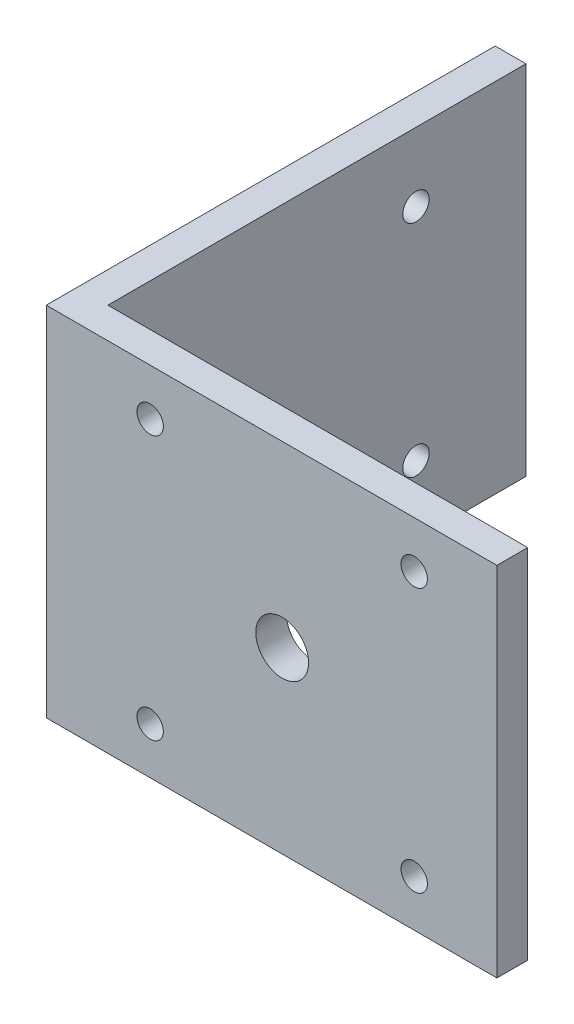
from build123d import *

# Parameters (mm, degrees)
BOSS_EXTRUDE1_DEPTH     = 40.6
CUT_EXTRUDE1_DEPTH      = 81.783971182
CUT_EXTRUDE1_DEPTH_BACK = 81.783971182
SKETCH2_R               = 1.5
CUT_EXTRUDE2_DEPTH      = 81.775305632
CUT_EXTRUDE2_DEPTH_BACK = 81.775305632
SKETCH3_R               = 1.5


with BuildPart() as part:
    # Sketch1 → Boss-Extrude1 (new body)
    with BuildSketch(Plane(origin=(0, 0, 0), x_dir=(1, 0, 0), z_dir=(0, 1, 0))):
        Polygon((0, 0), (0, 51), (3.5, 51), (3.5, 3.5), (51.2, 3.5), (51.2, 0), align=None)
    extrude(amount=BOSS_EXTRUDE1_DEPTH)

    # Sketch2 → Cut-Extrude1 (cut, two sides: drawn at the far end of the back side and taken through both)
    with BuildSketch(Plane(origin=(0, 0, -3.5), x_dir=(-1, 0, 0), z_dir=(0, 0, -1)).offset(-CUT_EXTRUDE1_DEPTH_BACK)):
        with BuildLine():
            ThreePointArc((-10.3, 35.3), (-10.414180701, 35.874025149), (-10.739339828, 36.360660172))
            Line((-10.739339828, 36.360660172), (-12.860660172, 34.239339828))
            ThreePointArc((-12.860660172, 34.239339828), (-11.225974851, 33.914180701), (-10.3, 35.3))
        make_face()
        with BuildLine():
            Line((-12.860660172, 34.239339828), (-10.739339828, 36.360660172))
            ThreePointArc((-10.739339828, 36.360660172), (-12.860660172, 36.360660172), (-12.860660172, 34.239339828))
        make_face()
        with Locations((-41.8, 35.3)):
            Circle(SKETCH2_R)
        with BuildLine():
            ThreePointArc((-23.8, 20.3), (-24.028361402, 21.448050297), (-24.678679656, 22.421320344))
            Line((-24.678679656, 22.421320344), (-28.921320344, 18.178679656))
            ThreePointArc((-28.921320344, 18.178679656), (-25.651949703, 17.528361402), (-23.8, 20.3))
        make_face()
        with BuildLine():
            Line((-28.921320344, 18.178679656), (-24.678679656, 22.421320344))
            ThreePointArc((-24.678679656, 22.421320344), (-28.921320344, 22.421320344), (-28.921320344, 18.178679656))
        make_face()
        with Locations((-11.8, 5.3)):
            Circle(SKETCH2_R)
        with BuildLine():
            ThreePointArc((-40.3, 5.3), (-40.414180701, 5.874025149), (-40.739339828, 6.360660172))
            Line((-40.739339828, 6.360660172), (-42.860660172, 4.239339828))
            ThreePointArc((-42.860660172, 4.239339828), (-41.225974851, 3.914180701), (-40.3, 5.3))
        make_face()
        with BuildLine():
            Line((-42.860660172, 4.239339828), (-40.739339828, 6.360660172))
            ThreePointArc((-40.739339828, 6.360660172), (-42.860660172, 6.360660172), (-42.860660172, 4.239339828))
        make_face()
    extrude(amount=CUT_EXTRUDE1_DEPTH + CUT_EXTRUDE1_DEPTH_BACK, mode=Mode.SUBTRACT)

    # Sketch3 → Cut-Extrude2 (cut, two sides: drawn at the far end of the back side and taken through both)
    with BuildSketch(Plane(origin=(3.5, 0, 0), x_dir=(0, 0, -1), z_dir=(1, 0, 0)).offset(-CUT_EXTRUDE2_DEPTH_BACK)):
        with BuildLine():
            ThreePointArc((37, 32.8), (38.5, 31.3), (40, 32.8))
            Line((40, 32.8), (37, 32.8))
        make_face()
        with BuildLine():
            Line((37, 32.8), (40, 32.8))
            ThreePointArc((40, 32.8), (38.5, 34.3), (37, 32.8))
        make_face()
        with BuildLine():
            ThreePointArc((7, 32.8), (8.5, 31.3), (10, 32.8))
            Line((10, 32.8), (7, 32.8))
        make_face()
        with BuildLine():
            Line((7, 32.8), (10, 32.8))
            ThreePointArc((10, 32.8), (8.5, 34.3), (7, 32.8))
        make_face()
        with Locations((8.5, 7.8)):
            Circle(SKETCH3_R)
        with Locations((38.5, 7.8)):
            Circle(SKETCH3_R)
    extrude(amount=CUT_EXTRUDE2_DEPTH + CUT_EXTRUDE2_DEPTH_BACK, mode=Mode.SUBTRACT)


solid = part.part
